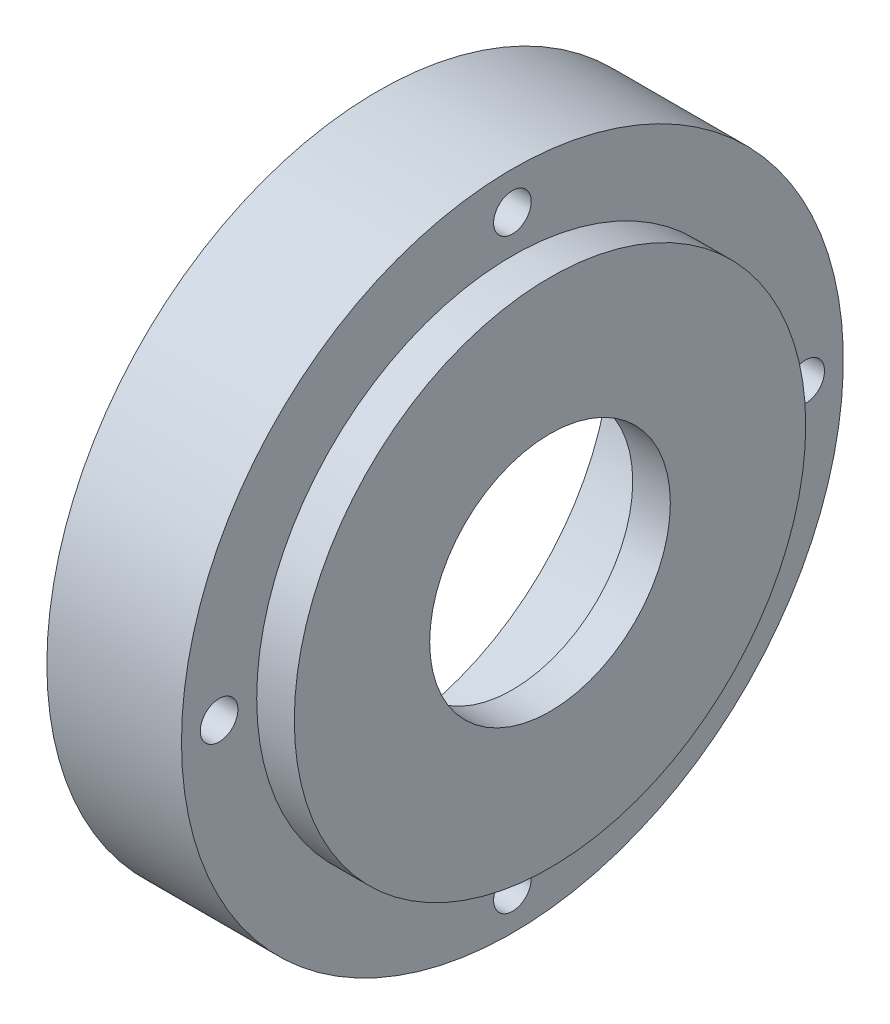
from build123d import *

# Parameters (mm, degrees)
SKETCH_1_R          = 44
SKETCH_1_R_2        = 31
EXTRUDE_1_DEPTH     = 17.9
SKETCH_2_R          = 2.5
CUT_EXTRUDE_1_DEPTH = 17.9
SKETCH_3_R          = 34
SKETCH_3_R_2        = 16
EXTRUDE_2_DEPTH     = 5


with BuildPart() as part:
    # 草图1 → 凸台-拉伸1 (new body)
    with BuildSketch(Plane(origin=(0, 0, 0), x_dir=(0, 0, -1), z_dir=(1, 0, 0))):
        with Locations(Location((0, 0, 0), (0, 0, 180))):
            Circle(SKETCH_1_R)
        with Locations(Location((0, 0, 0), (0, 0, 180))):
            Circle(SKETCH_1_R_2, mode=Mode.SUBTRACT)
    extrude(amount=EXTRUDE_1_DEPTH)

    # 草图2 → 切除-拉伸1 (cut)
    with BuildSketch(Plane(origin=(17.9, 0, 0), x_dir=(0, 0, -1), z_dir=(1, 0, 0))):
        with Locations((0, 39)):
            Circle(SKETCH_2_R)
        with Locations((39, 0)):
            Circle(SKETCH_2_R)
        with Locations((0, -39)):
            Circle(SKETCH_2_R)
        with Locations((-39, 0)):
            Circle(SKETCH_2_R)
    extrude(amount=-CUT_EXTRUDE_1_DEPTH, mode=Mode.SUBTRACT)

    # 草图3 → 凸台-拉伸2 (add)
    with BuildSketch(Plane(origin=(17.9, 0, 0), x_dir=(0, 0, -1), z_dir=(1, 0, 0))):
        Circle(SKETCH_3_R)
        Circle(SKETCH_3_R_2, mode=Mode.SUBTRACT)
    extrude(amount=EXTRUDE_2_DEPTH)


solid = part.part
